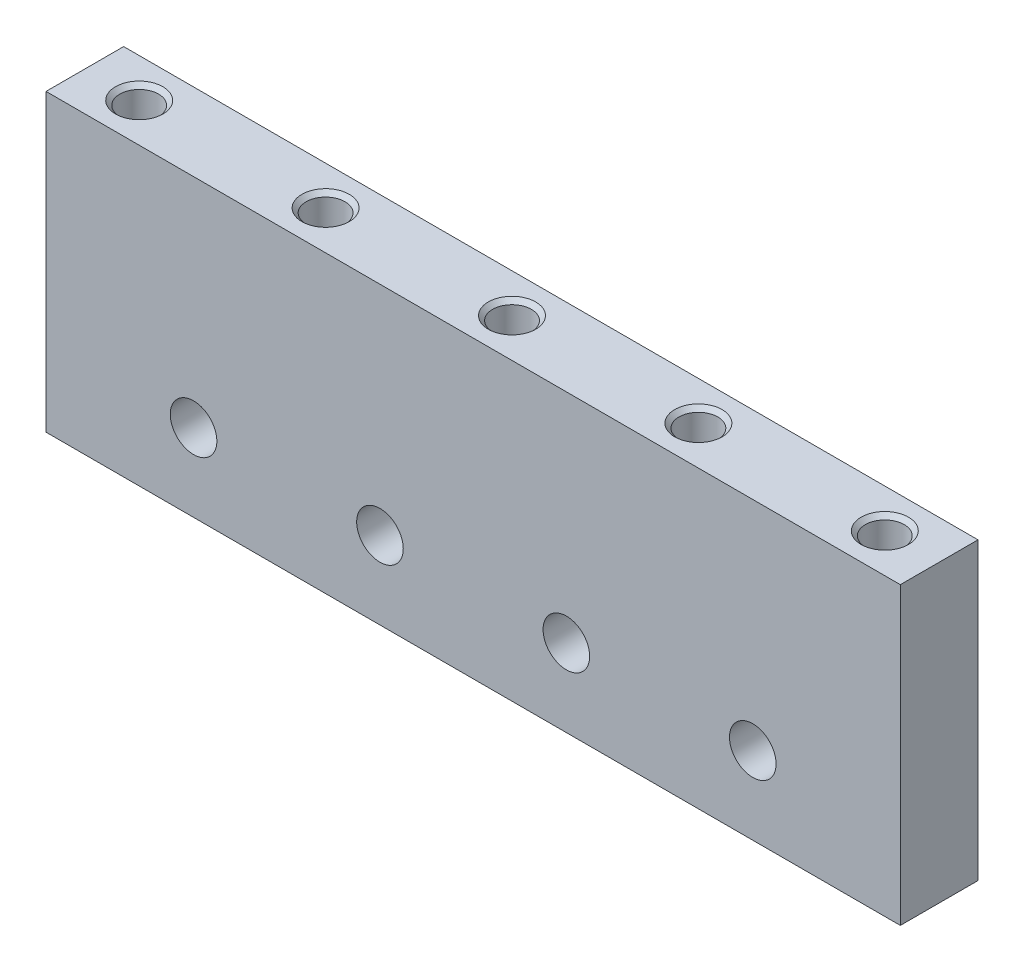
from build123d import *

# Parameters (mm, degrees)
SKETCH_1_W                   = 55
SKETCH_1_H                   = 19
SKETCH_1_R                   = 1.5
EXTRUDE_1_DEPTH              = 5
HOLE_WIZARD_M3_2_D           = 2.5
HOLE_WIZARD_M3_2_DEPTH       = 10
HOLE_WIZARD_M3_2_CSINK_D     = 3.05
HOLE_WIZARD_M3_2_CSINK_ANGLE = 90
HOLE_WIZARD_M3_2_TIP         = 0.751075774


with BuildPart() as part:
    # 草圖1 → 填料-伸長1 (new body)
    with BuildSketch(Plane.XY):
        Rectangle(SKETCH_1_W, SKETCH_1_H)
        with Locations((18, -4.5)):
            Circle(SKETCH_1_R, mode=Mode.SUBTRACT)
        with Locations((6, -4.5)):
            Circle(SKETCH_1_R, mode=Mode.SUBTRACT)
        with Locations((-6, -4.5)):
            Circle(SKETCH_1_R, mode=Mode.SUBTRACT)
        with Locations((-18, -4.5)):
            Circle(SKETCH_1_R, mode=Mode.SUBTRACT)
    extrude(amount=EXTRUDE_1_DEPTH)

    # M3 螺紋孔2
    with Locations(Plane(origin=(-24, 9.5, 2.5), x_dir=(1, 0, 0), z_dir=(0, 1, 0))):
        with Locations((0, 0), (12, 0), (24, 0), (36, 0), (48, 0)):
            CounterSinkHole(HOLE_WIZARD_M3_2_D / 2, HOLE_WIZARD_M3_2_CSINK_D / 2, depth=HOLE_WIZARD_M3_2_DEPTH, counter_sink_angle=HOLE_WIZARD_M3_2_CSINK_ANGLE)
            with Locations((0, 0, -(HOLE_WIZARD_M3_2_DEPTH + HOLE_WIZARD_M3_2_TIP / 2))):  # 118° drill point
                Cone(0, HOLE_WIZARD_M3_2_D / 2, HOLE_WIZARD_M3_2_TIP, mode=Mode.SUBTRACT)


solid = part.part
